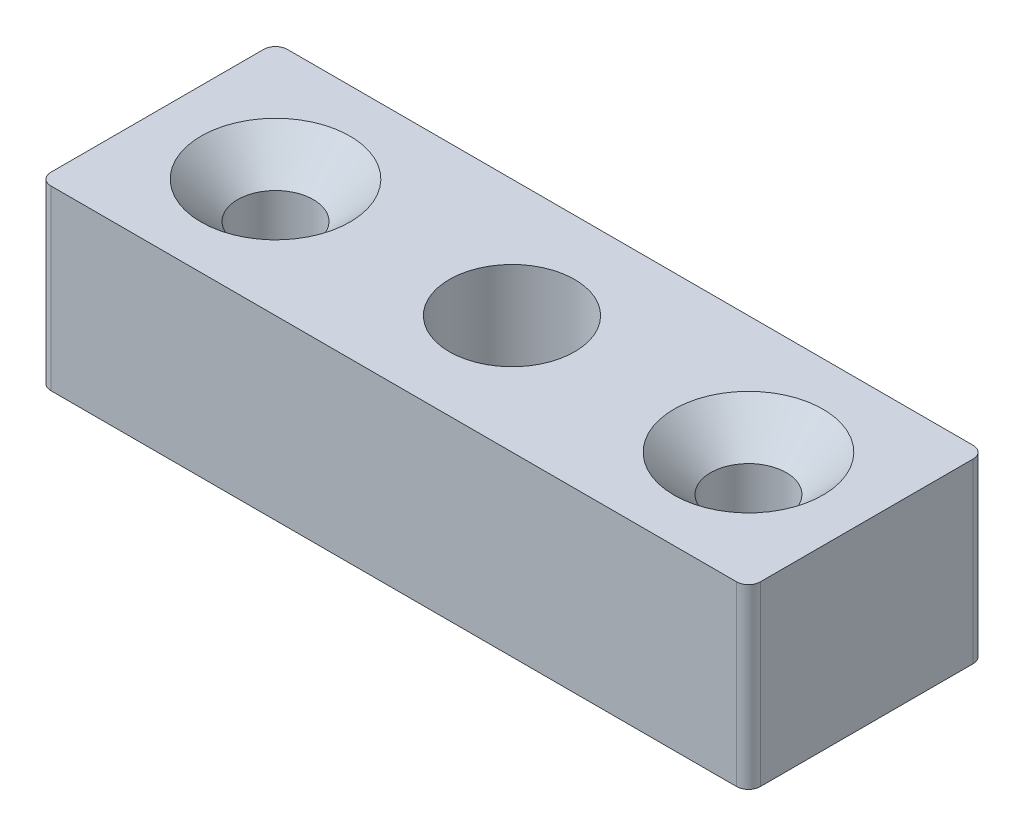
from build123d import *

# Parameters (mm, degrees)
SKETCH1_W                                       = 30
SKETCH1_H                                       = 10
BOSS_EXTRUDE1_DEPTH                             = 7.5
CSK_FOR_M3_FLAT_HEAD_MACHINE_SCREW1_D           = 3.2
CSK_FOR_M3_FLAT_HEAD_MACHINE_SCREW1_CSINK_D     = 6.3
CSK_FOR_M3_FLAT_HEAD_MACHINE_SCREW1_CSINK_ANGLE = 90
M5_CLEARANCE_HOLE1_D                            = 5.3
FILLET1_R                                       = 0.5


with BuildPart() as part:
    # Sketch1 → Boss-Extrude1 (new body)
    with BuildSketch(Plane(origin=(0, 0, 0), x_dir=(1, 0, 0), z_dir=(0, 1, 0))):
        Rectangle(SKETCH1_W, SKETCH1_H)
    extrude(amount=-BOSS_EXTRUDE1_DEPTH)

    # CSK for M3 Flat Head Machine Screw1 (through all)
    with Locations(Plane(origin=(-10, 0, 0), x_dir=(0, 0, 1), z_dir=(0, 1, 0))):
        with Locations((0, 0), (0, 20)):
            CounterSinkHole(CSK_FOR_M3_FLAT_HEAD_MACHINE_SCREW1_D / 2, CSK_FOR_M3_FLAT_HEAD_MACHINE_SCREW1_CSINK_D / 2, counter_sink_angle=CSK_FOR_M3_FLAT_HEAD_MACHINE_SCREW1_CSINK_ANGLE)

    # M5 Clearance Hole1 (through all)
    with Locations(Plane.ZX):
        with Locations((0, 0)):
            Hole(M5_CLEARANCE_HOLE1_D / 2)

    # Fillet1
    fillet1_edges = [part.edges().sort_by_distance(p)[0] for p in [
        (-15, -3.75, -5),
        (15, -3.75, -5),
        (15, -3.75, 5),
        (-15, -3.75, 5),
    ]]
    fillet(fillet1_edges, radius=FILLET1_R)


solid = part.part
